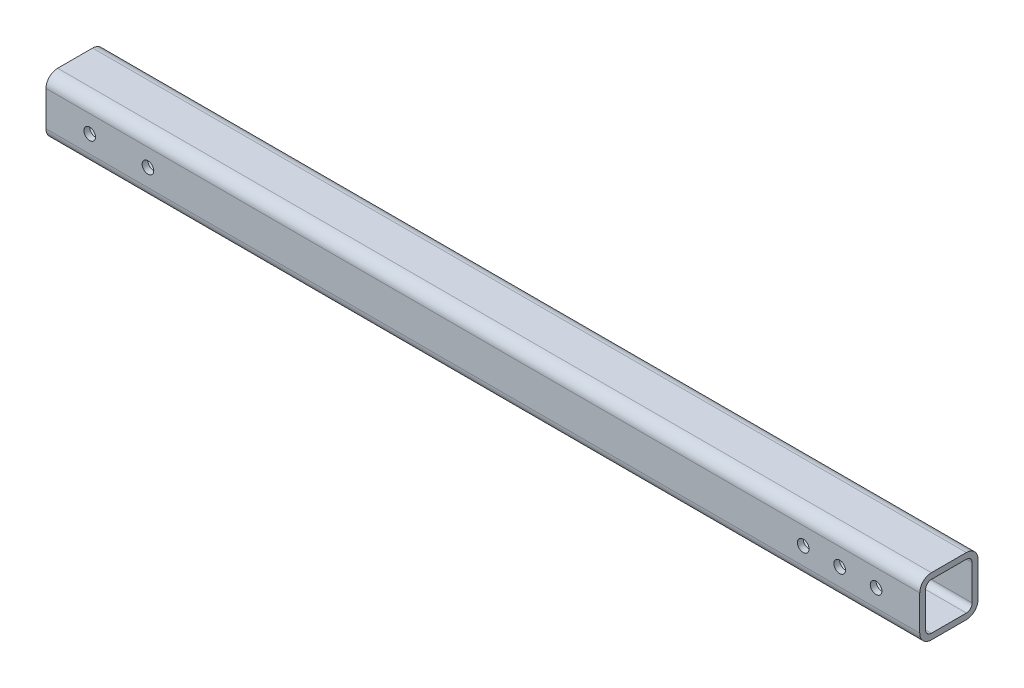
from build123d import *

# Parameters (mm, degrees)
TUBO_CUADRADO_40_X_40_X_4_1_DEPTH = 600
CROQUIS3_R                        = 4
CORTAR_EXTRUIR1_DEPTH             = 25


with BuildPart() as part:
    # Sketch1 → Tubo cuadrado 40 X 40 X 4(1) (new body)
    with BuildSketch(Plane(origin=(-300, 0, 0), x_dir=(0, 0, -1), z_dir=(1, 0, 0))):
        with BuildLine():
            Line((-12, -20), (12, -20))
            ThreePointArc((12, -20), (17.656854249, -17.656854249), (20, -12))
            Line((20, -12), (20, 12))
            ThreePointArc((20, 12), (17.656854249, 17.656854249), (12, 20))
            Line((12, 20), (-12, 20))
            ThreePointArc((-12, 20), (-17.656854249, 17.656854249), (-20, 12))
            Line((-20, 12), (-20, -12))
            ThreePointArc((-20, -12), (-17.656854249, -17.656854249), (-12, -20))
        make_face()
        with BuildLine():
            Line((-12, -16), (12, -16))
            ThreePointArc((12, -16), (14.828427125, -14.828427125), (16, -12))
            Line((16, -12), (16, 12))
            ThreePointArc((16, 12), (14.828427125, 14.828427125), (12, 16))
            Line((12, 16), (-12, 16))
            ThreePointArc((-12, 16), (-14.828427125, 14.828427125), (-16, 12))
            Line((-16, 12), (-16, -12))
            ThreePointArc((-16, -12), (-14.828427125, -14.828427125), (-12, -16))
        make_face(mode=Mode.SUBTRACT)
    extrude(amount=TUBO_CUADRADO_40_X_40_X_4_1_DEPTH)

    # Croquis3 → Cortar-Extruir1 (cut, symmetric)
    with BuildSketch(Plane.XY):
        with Locations((-270, 0)):
            Circle(CROQUIS3_R)
        with Locations((-230, 0)):
            Circle(CROQUIS3_R)
        with Locations((220, 0)):
            Circle(CROQUIS3_R)
        with Locations((245, 0)):
            Circle(CROQUIS3_R)
        with Locations((270, 0)):
            Circle(CROQUIS3_R)
    extrude(amount=CORTAR_EXTRUIR1_DEPTH, both=True, mode=Mode.SUBTRACT)


solid = part.part
